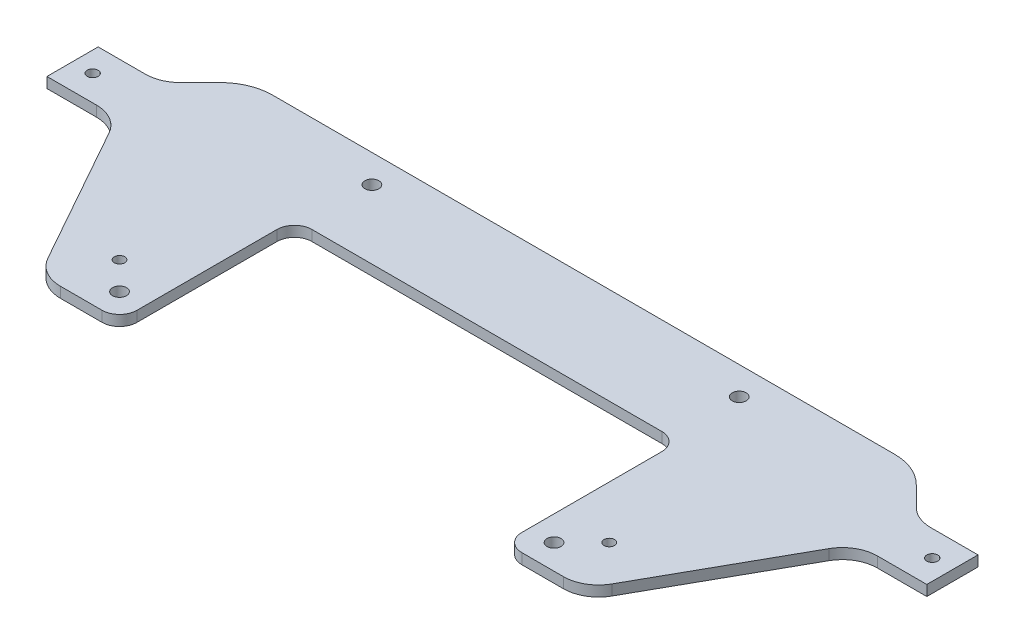
from build123d import *

# Parameters (mm, degrees)
SALIENTE_EXTRUIR1_DEPTH = 3
REDONDEO1_R             = 10
CROQUIS2_R              = 1.5
CROQUIS2_R_2            = 1.55
CORTAR_EXTRUIR1_DEPTH   = 135.610141171
CROQUIS4_W              = 110
CROQUIS4_H              = 50
CORTAR_EXTRUIR2_DEPTH   = 135.610141171
REDONDEO2_R             = 5
CROQUIS5_W              = 4
CROQUIS5_H              = 14.636342218
CORTAR_EXTRUIR3_DEPTH   = 135.610141171
CROQUIS6_W              = 14.636342218
CROQUIS6_H              = 3
SALIENTE_EXTRUIR2_DEPTH = 2
CROQUIS8_W              = 14.636342218
CROQUIS8_H              = 3
SALIENTE_EXTRUIR3_DEPTH = 2
CROQUIS9_W              = 196.2
CROQUIS9_H              = 31.087527503
CORTAR_EXTRUIR4_DEPTH   = 133.713564137
CROQUIS10_R             = 2
CORTAR_EXTRUIR5_DEPTH   = 133.713564137
REDONDEO6_R             = 15
CROQUIS11_R             = 2
CORTAR_EXTRUIR6_DEPTH   = 10


with BuildPart() as part:
    # Croquis1 → Saliente-Extruir1 (new body)
    with BuildSketch(Plane(origin=(0, 0, 0), x_dir=(1, 0, 0), z_dir=(0, 1, 0))):
        Polygon((-88.1, 42.318171109), (88.1, 42.318171109), (108.1, 22.318171109), (127.75, 22.318171109), (127.75, 7.681828891), (105.75, 7.681828891), (77.75, -42.318171109), (-77.75, -42.318171109), (-105.75, 7.681828891), (-127.75, 7.681828891), (-127.75, 22.318171109), (-108.1, 22.318171109), align=None)
    extrude(amount=SALIENTE_EXTRUIR1_DEPTH)

    # Redondeo1
    redondeo1_edges = [part.edges().sort_by_distance(p)[0] for p in [
        (-88.1, 1.5, -42.318171109),
        (88.1, 1.5, -42.318171109),
        (108.1, 1.5, -22.318171109),
        (105.75, 1.5, -7.681828891),
        (77.75, 1.5, 42.318171109),
        (-77.75, 1.5, 42.318171109),
        (-105.75, 1.5, -7.681828891),
        (-108.1, 1.5, -22.318171109),
    ]]
    fillet(redondeo1_edges, radius=REDONDEO1_R)

    # Croquis2 → Cortar-Extruir1 (cut, through all)
    with BuildSketch(Plane(origin=(0, 3, 0), x_dir=(1, 0, 0), z_dir=(0, 1, 0))):
        with Locations(Location((70, -27.318171109, 0), (0, 0, 270))):
            Circle(CROQUIS2_R)
        with Locations(Location((-70, -27.318171109, 0), (0, 0, 270))):
            Circle(CROQUIS2_R)
        with Locations(Location((-119.996067812, 15, 0), (0, 0, 270))):
            Circle(CROQUIS2_R_2)
        with Locations(Location((119.996067812, 15, 0), (0, 0, 270))):
            Circle(CROQUIS2_R_2)
        with Locations(Location((-17.5, -17.318171109, 0), (0, 0, 270))):
            Circle(CROQUIS2_R)
        with Locations(Location((17.5, -17.318171109, 0), (0, 0, 270))):
            Circle(CROQUIS2_R)
        with Locations(Location((-17.5, -37.318171109, 0), (0, 0, 270))):
            Circle(CROQUIS2_R)
        with Locations(Location((17.5, -37.318171109, 0), (0, 0, 270))):
            Circle(CROQUIS2_R)
    extrude(amount=-CORTAR_EXTRUIR1_DEPTH, mode=Mode.SUBTRACT)

    # Croquis4 → Cortar-Extruir2 (cut, through all)
    with BuildSketch(Plane(origin=(0, 3, 0), x_dir=(1, 0, 0), z_dir=(0, 1, 0))):
        with Locations((0, -17.318171109)):
            Rectangle(CROQUIS4_W, CROQUIS4_H)
    extrude(amount=-CORTAR_EXTRUIR2_DEPTH, mode=Mode.SUBTRACT)

    # Redondeo2
    redondeo2_edges = [part.edges().sort_by_distance(p)[0] for p in [
        (55, 1.5, 42.318171109),
        (-55, 1.5, 42.318171109),
        (-55, 1.5, -7.681828891),
        (55, 1.5, -7.681828891),
    ]]
    fillet(redondeo2_edges, radius=REDONDEO2_R)

    # Croquis5 → Cortar-Extruir3 (cut, through all)
    with BuildSketch(Plane(origin=(0, 3, 0), x_dir=(1, 0, 0), z_dir=(0, 1, 0))):
        with Locations((-125.75, 15)):
            Rectangle(CROQUIS5_W, CROQUIS5_H)
        with Locations((125.75, 15)):
            Rectangle(CROQUIS5_W, CROQUIS5_H)
    extrude(amount=-CORTAR_EXTRUIR3_DEPTH, mode=Mode.SUBTRACT)

    # Croquis6 → Saliente-Extruir2 (add)
    with BuildSketch(Plane(origin=(123.75, 0, 0), x_dir=(0, 0, -1), z_dir=(1, 0, 0))):
        with Locations((15, 1.5)):
            Rectangle(CROQUIS6_W, CROQUIS6_H)
    extrude(amount=SALIENTE_EXTRUIR2_DEPTH)

    # Croquis8 → Saliente-Extruir3 (add)
    with BuildSketch(Plane.ZY.offset(123.75)):
        with Locations((-15, 1.5)):
            Rectangle(CROQUIS8_W, CROQUIS8_H)
    extrude(amount=SALIENTE_EXTRUIR3_DEPTH)

    # Croquis9 → Cortar-Extruir4 (cut, through all)
    with BuildSketch(Plane(origin=(0, 3, 0), x_dir=(1, 0, 0), z_dir=(0, 1, 0))):
        with Locations((0, 50.861934861)):
            Rectangle(CROQUIS9_W, CROQUIS9_H)
    extrude(amount=-CORTAR_EXTRUIR4_DEPTH, mode=Mode.SUBTRACT)

    # Croquis10 → Cortar-Extruir5 (cut, through all)
    with BuildSketch(Plane(origin=(0, 3, 0), x_dir=(1, 0, 0), z_dir=(0, 1, 0))):
        with Locations(Location((-52.5, 27.318171109, 0), (0, 0, 270))):
            Circle(CROQUIS10_R)
        with Locations(Location((52.5, 27.318171109, 0), (0, 0, 270))):
            Circle(CROQUIS10_R)
    extrude(amount=-CORTAR_EXTRUIR5_DEPTH, mode=Mode.SUBTRACT)

    # Redondeo6
    redondeo6_edges = [part.edges().sort_by_distance(p)[0] for p in [
        (-95.1, 1.5, -35.318171109),
        (95.1, 1.5, -35.318171109),
    ]]
    fillet(redondeo6_edges, radius=REDONDEO6_R)

    # Croquis11 → Cortar-Extruir6 (cut)
    with BuildSketch(Plane(origin=(0, 3, 0), x_dir=(1, 0, 0), z_dir=(0, 1, 0))):
        with Locations(Location((-62.1, -35.218171109, 0), (0, 0, 270))):
            Circle(CROQUIS11_R)
        with Locations(Location((62.1, -35.218171109, 0), (0, 0, 270))):
            Circle(CROQUIS11_R)
    extrude(amount=-CORTAR_EXTRUIR6_DEPTH, mode=Mode.SUBTRACT)


solid = part.part
